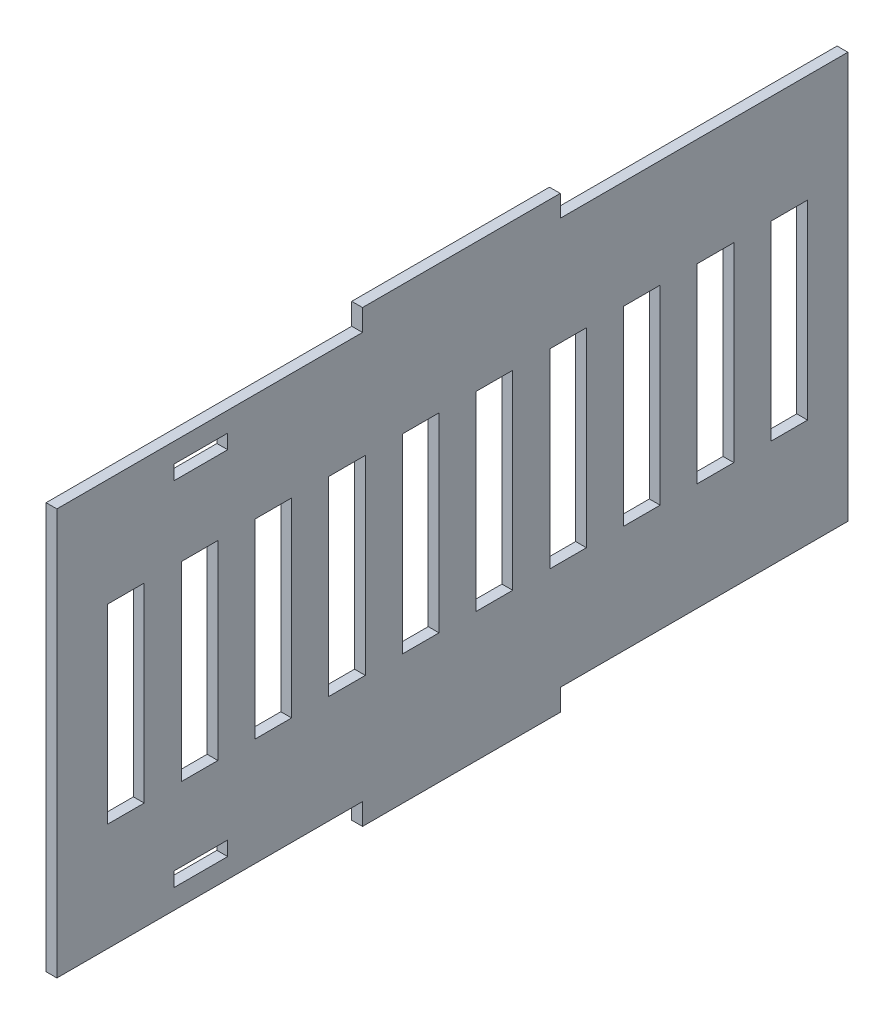
from build123d import *

# Parameters (mm, degrees)
SKETCH2_W           = 220
SKETCH2_H           = 125
BOSS_EXTRUDE1_DEPTH = 3
SKETCH3_W           = 80
SKETCH3_H           = 6
SKETCH3_W_2         = 85
CUT_EXTRUDE1_DEPTH  = 3
SKETCH4_W           = 10.189923803
SKETCH4_H           = 53
CUT_EXTRUDE2_DEPTH  = 3
SKETCH6_W           = 15
SKETCH6_H           = 4
CUT_EXTRUDE3_DEPTH  = 10


with BuildPart() as part:
    # Sketch2 → Boss-Extrude1 (new body)
    with BuildSketch(Plane(origin=(0, 0, 0), x_dir=(0, 0, -1), z_dir=(1, 0, 0))):
        with Locations((-110, 62.5)):
            Rectangle(SKETCH2_W, SKETCH2_H)
    extrude(amount=BOSS_EXTRUDE1_DEPTH)

    # Sketch3 → Cut-Extrude1 (cut)
    with BuildSketch(Plane.ZY):
        with Locations((40, 122)):
            Rectangle(SKETCH3_W, SKETCH3_H)
        with Locations((40, 3)):
            Rectangle(SKETCH3_W, SKETCH3_H)
        with Locations((177.5, 122)):
            Rectangle(SKETCH3_W_2, SKETCH3_H)
        with Locations((177.5, 3)):
            Rectangle(SKETCH3_W_2, SKETCH3_H)
    extrude(amount=-CUT_EXTRUDE1_DEPTH, mode=Mode.SUBTRACT)

    # Sketch4 → Cut-Extrude2 (cut)
    with BuildSketch(Plane.ZY):
        with Locations((16.315088301, 62.5)):
            Rectangle(SKETCH4_W, SKETCH4_H)
        with Locations((36.815088301, 62.5)):
            Rectangle(SKETCH4_W, SKETCH4_H)
        with Locations((57.315088301, 62.5)):
            Rectangle(SKETCH4_W, SKETCH4_H)
        with Locations((77.815088301, 62.5)):
            Rectangle(SKETCH4_W, SKETCH4_H)
        with Locations((98.315088301, 62.5)):
            Rectangle(SKETCH4_W, SKETCH4_H)
        with Locations((118.815088301, 62.5)):
            Rectangle(SKETCH4_W, SKETCH4_H)
        with Locations((139.315088301, 62.5)):
            Rectangle(SKETCH4_W, SKETCH4_H)
        with Locations((159.815088301, 62.5)):
            Rectangle(SKETCH4_W, SKETCH4_H)
        with Locations((180.315088301, 62.5)):
            Rectangle(SKETCH4_W, SKETCH4_H)
        with Locations((200.815088301, 62.5)):
            Rectangle(SKETCH4_W, SKETCH4_H)
    extrude(amount=-CUT_EXTRUDE2_DEPTH, mode=Mode.SUBTRACT)

    # Sketch6 → Cut-Extrude3 (cut)
    with BuildSketch(Plane.ZY):
        with Locations((180, 111.5)):
            Rectangle(SKETCH6_W, SKETCH6_H)
        with Locations((180, 13.5)):
            Rectangle(SKETCH6_W, SKETCH6_H)
    extrude(amount=-CUT_EXTRUDE3_DEPTH, mode=Mode.SUBTRACT)


solid = part.part
